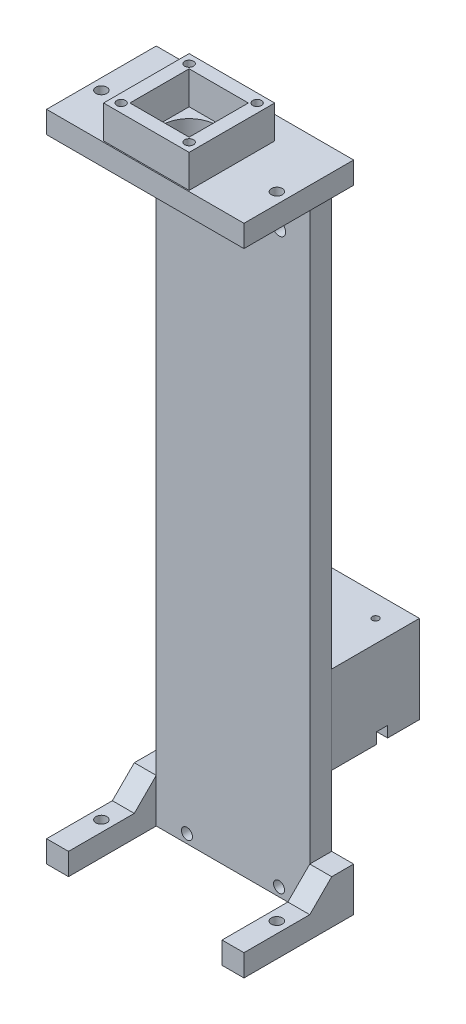
from build123d import *

# Parameters (mm, degrees)
SKETCH_1_W               = 70
SKETCH_1_H               = 40
EXTRUDE_1_DEPTH          = 40
SKETCH_2_R               = 1.5
CUT_EXTRUDE_1_DEPTH      = 60.579081363
EXTRUDE_2_DEPTH          = 52
EXTRUDE_2_DEPTH_BACK     = 236
SKETCH_4_W               = 70
SKETCH_4_H               = 10
SKETCH_5_R               = 2.5
CUT_EXTRUDE_2_DEPTH      = 10
SKETCH_6_R               = 3
CUT_EXTRUDE_3_DEPTH      = 10
SKETCH_7_W               = 70
SKETCH_7_H               = 10
EXTRUDE_3_DEPTH          = 50
SKETCH_8_R               = 12.5
CUT_EXTRUDE_4_DEPTH      = 10
SKETCH_12_W              = 39
SKETCH_12_H              = 39
SKETCH_12_W_2            = 27
SKETCH_12_H_2            = 27
EXTRUDE_2_2_DEPTH        = 15
SKETCH_14_R              = 2
CUT_EXTRUDE_5_DEPTH      = 25
SKETCH_15_W              = 70
SKETCH_15_H              = 5
CUT_EXTRUDE_6_DEPTH      = 5
SKETCH_16_W              = 50
SKETCH_16_H              = 10
EXTRUDE_5_DEPTH          = 10
MIRROR_2_COPY_1_SKETCH_W = 50
MIRROR_2_COPY_1_SKETCH_H = 10
MIRROR_2_COPY_1_DEPTH    = 10
SKETCH_17_R              = 2.5
CUT_EXTRUDE_7_DEPTH      = 325.880687163
SKETCH_18_R              = 2.5
EXTRUDE_6_DEPTH          = 5
SKETCH_21_W              = 10
SKETCH_21_H              = 10
EXTRUDE_8_DEPTH          = 10
EXTRUDE_9_DEPTH          = 10
EXTRUDE_10_DEPTH         = 10


with BuildPart() as part:
    # 草图1 → 凸台-拉伸1 (new body)
    with BuildSketch(Plane(origin=(0, 0, 0), x_dir=(1, 0, 0), z_dir=(0, 1, 0))):
        with Locations((2.864103165, -2.71511892)):
            Rectangle(SKETCH_1_W, SKETCH_1_H)
    extrude(amount=EXTRUDE_1_DEPTH)

    # 草图2 → 切除-拉伸1 (cut, through all)
    with BuildSketch(Plane.XZ):
        with Locations(Location((-22.135896835, 17.71511892, 0), (0, 0, 270))):
            Circle(SKETCH_2_R)
        with Locations(Location((27.864103165, 17.71511892, 0), (0, 0, 90))):
            Circle(SKETCH_2_R)
        with Locations(Location((-22.135896835, -7.28488108, 0), (0, 0, 270))):
            Circle(SKETCH_2_R)
        with Locations(Location((27.864103165, -7.28488108, 0), (0, 0, 90))):
            Circle(SKETCH_2_R)
    extrude(amount=-CUT_EXTRUDE_1_DEPTH, mode=Mode.SUBTRACT)

    # 草图15 → 切除-拉伸6 (cut)
    with BuildSketch(Plane.XZ):
        with Locations((2.864103165, -0.28488108)):
            Rectangle(SKETCH_15_W, SKETCH_15_H)
    extrude(amount=-CUT_EXTRUDE_6_DEPTH, mode=Mode.SUBTRACT)


with BuildPart() as body_2:
    # 草图4 → Extrude 2 (new, two sides: drawn at the far end of the back side and taken through both)
    with BuildSketch(Plane.XZ.offset(-EXTRUDE_2_DEPTH_BACK)):
        with Locations((2.864103165, 27.71511892)):
            Rectangle(SKETCH_4_W, SKETCH_4_H)
    extrude(amount=EXTRUDE_2_DEPTH + EXTRUDE_2_DEPTH_BACK)

    # 草图5 → 切除-拉伸2 (cut)
    with BuildSketch(Plane.XY.offset(32.71511892)):
        with Locations((-18.135896835, -48)):
            Circle(SKETCH_5_R)
        with Locations(Location((23.864103165, -48, 0), (0, 0, 180))):
            Circle(SKETCH_5_R)
    extrude(amount=-CUT_EXTRUDE_2_DEPTH, mode=Mode.SUBTRACT)

    # 草图6 → 切除-拉伸3 (cut)
    with BuildSketch(Plane.XY.offset(32.71511892)):
        with Locations((-18.135896835, 212)):
            Circle(SKETCH_6_R)
        with Locations(Location((23.864103165, 212, 0), (0, 0, 180))):
            Circle(SKETCH_6_R)
    extrude(amount=-CUT_EXTRUDE_3_DEPTH, mode=Mode.SUBTRACT)

    # 草图7 → 凸台-拉伸3 (add)
    with BuildSketch(Plane(origin=(0, 0, 22.71511892), x_dir=(-1, 0, 0), z_dir=(0, 0, -1))):
        with Locations((-2.864103165, 241)):
            Rectangle(SKETCH_7_W, SKETCH_7_H)
    extrude(amount=-EXTRUDE_3_DEPTH)

    # 草图8 → 切除-拉伸4 (cut)
    with BuildSketch(Plane.XZ.offset(-236)):
        with Locations(Location((2.864103165, 52.71511892, 0), (0, 0, 270))):
            Circle(SKETCH_8_R)
    extrude(amount=-CUT_EXTRUDE_4_DEPTH, mode=Mode.SUBTRACT)

    # 草图12 → Extrude 2 2 (add)
    with BuildSketch(Plane(origin=(0, 246, 0), x_dir=(1, 0, 0), z_dir=(0, 1, 0))):
        with Locations((2.864103165, -52.71511892)):
            Rectangle(SKETCH_12_W, SKETCH_12_H)
        with Locations((2.864103165, -52.71511892)):
            Rectangle(SKETCH_12_W_2, SKETCH_12_H_2, mode=Mode.SUBTRACT)
    extrude(amount=EXTRUDE_2_2_DEPTH)

    # 草图14 → 切除-拉伸5 (cut)
    with BuildSketch(Plane(origin=(0, 261, 0), x_dir=(1, 0, 0), z_dir=(0, 1, 0))):
        with Locations(Location((-12.635896835, -37.21511892, 0), (0, 0, 270))):
            Circle(SKETCH_14_R)
        with Locations(Location((18.364103165, -37.21511892, 0), (0, 0, 90))):
            Circle(SKETCH_14_R)
        with Locations(Location((-12.635896835, -68.21511892, 0), (0, 0, 90))):
            Circle(SKETCH_14_R)
        with Locations(Location((18.364103165, -68.21511892, 0), (0, 0, 270))):
            Circle(SKETCH_14_R)
    extrude(amount=-CUT_EXTRUDE_5_DEPTH, mode=Mode.SUBTRACT)

    # 草图16 → 凸台-拉伸5 (add)
    with BuildSketch(Plane.ZY.offset(32.135896835)):
        with Locations((47.71511892, 241)):
            Rectangle(SKETCH_16_W, SKETCH_16_H)
    extrude_5 = extrude(amount=EXTRUDE_5_DEPTH)

    # 镜向1: 凸台-拉伸5 across plane
    add(extrude_5.mirror(Plane.ZX.offset(97)))

    # 镜向2: 凸台-拉伸5 across plane
    add(extrude_5.mirror(Plane.ZY.offset(-2.864103165)))

    # 镜向2 copy 1 sketch → 镜向2 copy 1 (add)
    with BuildSketch(Plane(origin=(37.864103165, 194, 0), x_dir=(0, 0, 1), z_dir=(1, 0, 0))):
        with Locations((47.71511892, 241)):
            Rectangle(MIRROR_2_COPY_1_SKETCH_W, MIRROR_2_COPY_1_SKETCH_H)
    extrude(amount=MIRROR_2_COPY_1_DEPTH)

    # 草图17 → 切除-拉伸7 (cut, through all)
    with BuildSketch(Plane.XZ.offset(52)):
        with Locations(Location((-37.135896835, 52.71511892, 0), (0, 0, 270))):
            Circle(SKETCH_17_R)
        with Locations(Location((42.864103165, 52.71511892, 0), (0, 0, 270))):
            Circle(SKETCH_17_R)
    extrude(amount=-CUT_EXTRUDE_7_DEPTH, mode=Mode.SUBTRACT)

    # 草图18 → 凸台-拉伸6 (add)
    with BuildSketch(Plane.XZ.offset(52)):
        with Locations(Location((-37.135896835, 52.71511892, 0), (0, 0, 270))):
            Circle(SKETCH_18_R)
        with Locations(Location((42.864103165, 52.71511892, 0), (0, 0, 270))):
            Circle(SKETCH_18_R)
    extrude(amount=-EXTRUDE_6_DEPTH)

    # 草图21 → 凸台-拉伸8 (add)
    with BuildSketch(Plane(origin=(0, 0, 22.71511892), x_dir=(-1, 0, 0), z_dir=(0, 0, -1))):
        with Locations((-42.864103165, -37)):
            Rectangle(SKETCH_21_W, SKETCH_21_H)
    extrude_8 = extrude(amount=-EXTRUDE_8_DEPTH)

    # 镜向3: 凸台-拉伸8 across plane
    add(extrude_8.mirror(Plane.ZY.offset(-2.864103165)))

    # 草图22 → 凸台-拉伸9 (add)
    with BuildSketch(Plane(origin=(47.864103165, 0, 0), x_dir=(0, 0, -1), z_dir=(1, 0, 0))):
        Polygon((-32.71511892, -32), (-42.71511892, -42), (-32.71511892, -42), align=None)
    extrude(amount=-EXTRUDE_9_DEPTH)

    # 草图23 → 凸台-拉伸10 (add)
    with BuildSketch(Plane.ZY.offset(42.135896835)):
        Polygon((32.71511892, -32), (42.71511892, -42), (32.71511892, -42), align=None)
    extrude(amount=-EXTRUDE_10_DEPTH)


solid = Compound([part.part, body_2.part])
